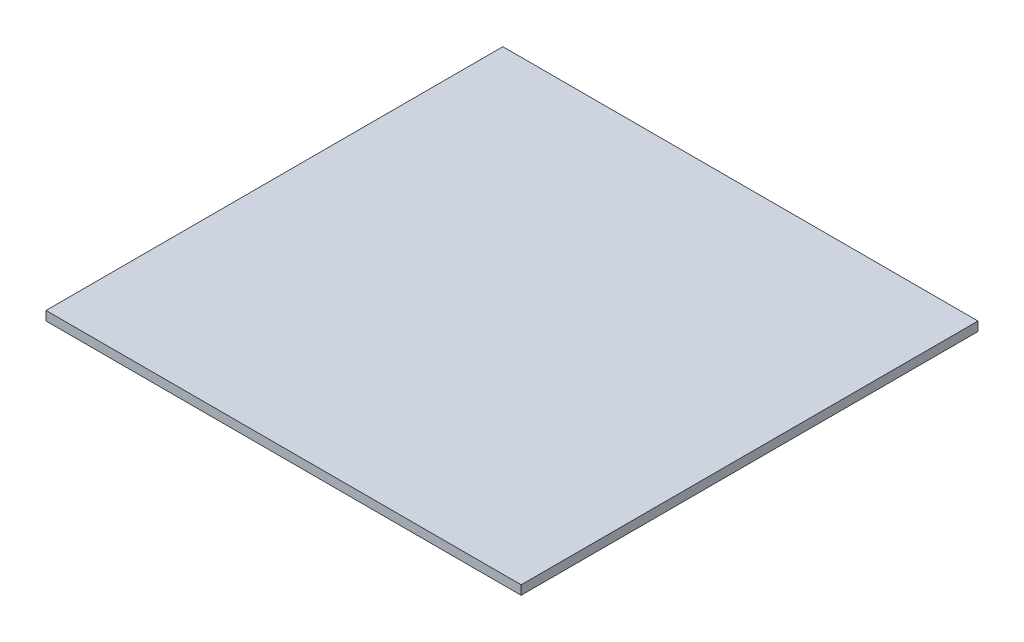
from build123d import *

# Parameters (mm, degrees)
ESQUISSE1_W        = 260
ESQUISSE1_H        = 250
BOSS_EXTRU_2_DEPTH = 5


with BuildPart() as part:
    # Esquisse1 → Boss.-Extru.2 (new body)
    with BuildSketch(Plane(origin=(0, 0, 0), x_dir=(1, 0, 0), z_dir=(0, 1, 0))):
        with Locations((130, 125)):
            Rectangle(ESQUISSE1_W, ESQUISSE1_H)
    extrude(amount=BOSS_EXTRU_2_DEPTH)


solid = part.part
